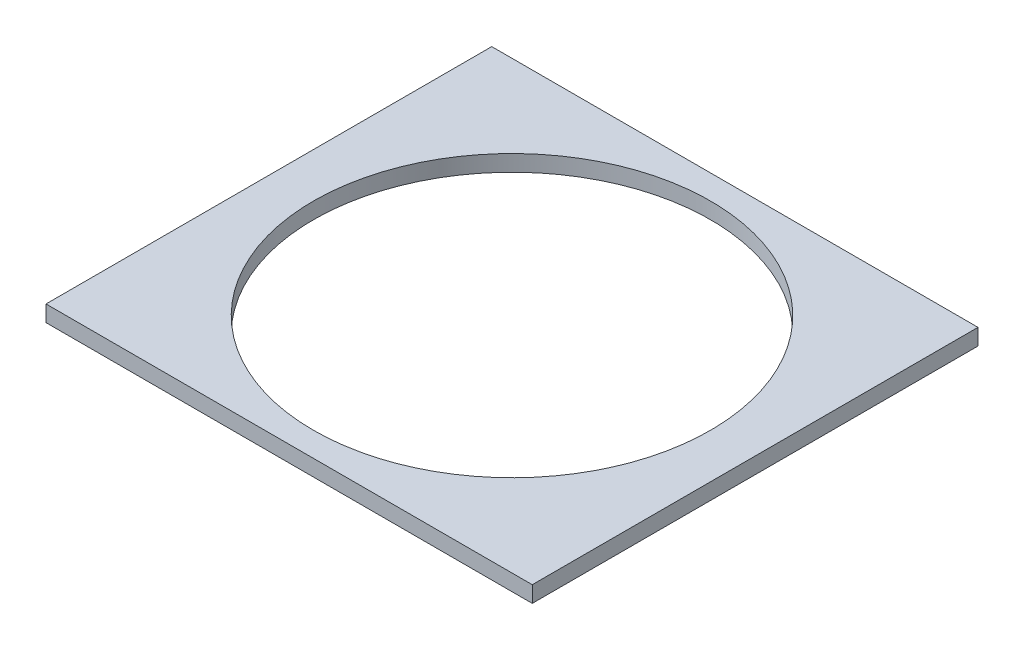
from build123d import *

# Parameters (mm, degrees)
IZIM1_W                     = 60
IZIM1_H                     = 55
Y_KSEKLIK_EKSTR_ZYON1_DEPTH = 2
IZIM2_R                     = 24.5
KES_EKSTR_ZYON1_DEPTH       = 2


with BuildPart() as part:
    # Çizim1 → Yükseklik-Ekstrüzyon1 (new body)
    with BuildSketch(Plane(origin=(0, 0, 0), x_dir=(1, 0, 0), z_dir=(0, 1, 0))):
        with Locations((30, -27.5)):
            Rectangle(IZIM1_W, IZIM1_H)
    extrude(amount=Y_KSEKLIK_EKSTR_ZYON1_DEPTH)

    # Çizim2 → Kes-Ekstrüzyon1 (cut)
    with BuildSketch(Plane(origin=(0, 2, 0), x_dir=(1, 0, 0), z_dir=(0, 1, 0))):
        with Locations(Location((30, -27.5, 0), (0, 0, 270))):
            Circle(IZIM2_R)
    extrude(amount=-KES_EKSTR_ZYON1_DEPTH, mode=Mode.SUBTRACT)


solid = part.part
